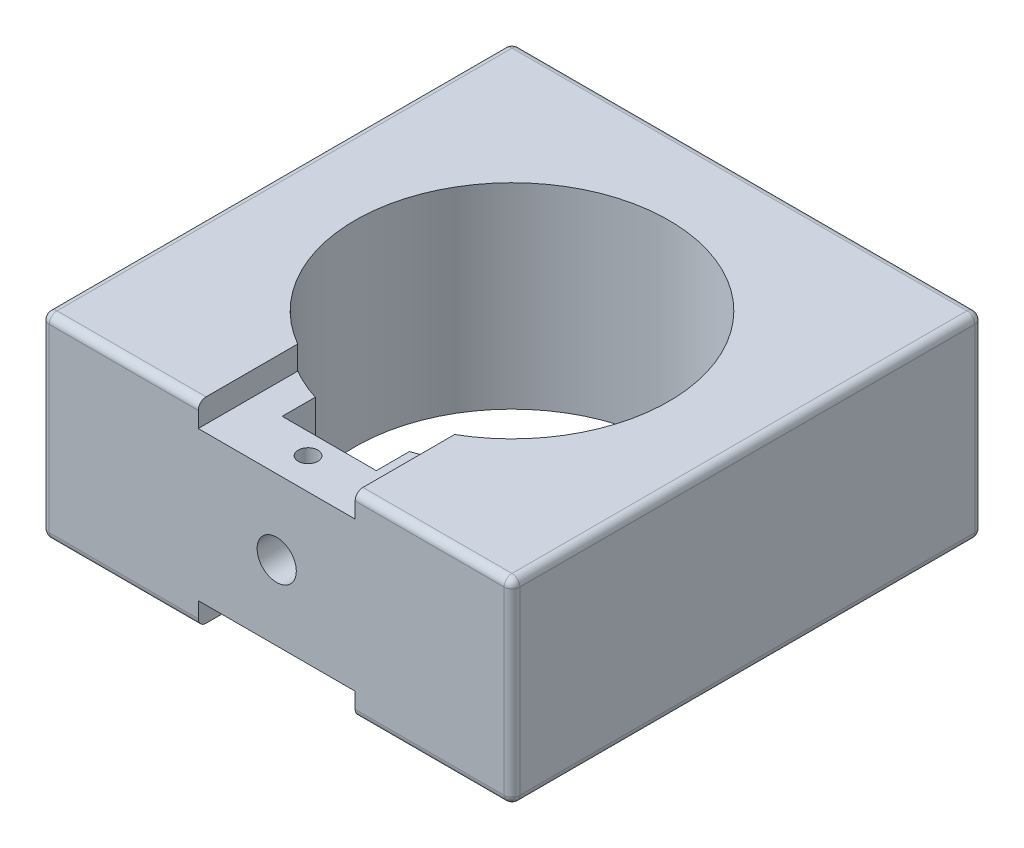
from build123d import *

# Parameters (mm, degrees)
ESQUISSE1_W             = 60
ESQUISSE1_H             = 60
ESQUISSE1_R             = 20
BOSS_EXTRU_1_DEPTH      = 25
CONG_1_R                = 1
TROU_TARAUD_M61_REACH   = 73.589
TROU_TARAUD_M61_BORE_R  = 2.5
TROU_TARAUD_M41_D       = 3.3
TROU_TARAUD_M41_DEPTH   = 7.5
TROU_TARAUD_M41_TIP     = 0.991420021
TROU_TARAUD_M42_D       = 3.3
TROU_TARAUD_M42_DEPTH   = 10.5
TROU_TARAUD_M42_TIP     = 0.991420021
ENL_V_MAT_EXTRU_1_REACH = 51.244
ENL_V_MAT_EXTRU_2_DEPTH = 3


with BuildPart() as part:
    # Esquisse1 → Boss.-Extru.1 (new body)
    with BuildSketch(Plane(origin=(0, 0, 0), x_dir=(1, 0, 0), z_dir=(0, 1, 0))):
        Rectangle(ESQUISSE1_W, ESQUISSE1_H)
        with Locations(Location((0, 0, 0), (0, 0, 270))):
            Circle(ESQUISSE1_R, mode=Mode.SUBTRACT)
    extrude(amount=BOSS_EXTRU_1_DEPTH)

    # Congé1
    cong_1_edges = [part.edges().sort_by_distance(p)[0] for p in [
        (30, 25, 0),
        (0, 25, -30),
        (-30, 25, 0),
        (0, 0, -30),
        (30, 0, 0),
        (0, 0, 30),
        (-30, 0, 0),
        (0, 25, 30),
        (-30, 12.5, -30),
        (30, 12.5, -30),
        (30, 12.5, 30),
        (-30, 12.5, 30),
    ]]
    fillet(cong_1_edges, radius=CONG_1_R)

    # Trou taraudé M61 bore → Trou taraudé M61 (cut, up to next)
    with BuildSketch(Plane.XY.offset(30), mode=Mode.PRIVATE) as trou_taraud_m61_sk1:
        with Locations((0, 12.5)):
            Circle(TROU_TARAUD_M61_BORE_R)
    trou_taraud_m61_tool1 = extrude(trou_taraud_m61_sk1.sketch, amount=-TROU_TARAUD_M61_REACH, mode=Mode.PRIVATE) & part.part
    add(trou_taraud_m61_tool1.solids().sort_by_distance((0, 12.5, 30))[0], mode=Mode.SUBTRACT)

    # Trou taraudé M41
    with Locations(Plane(origin=(0, 0, -30), x_dir=(-1, 0, 0), z_dir=(0, 0, -1))):
        with Locations((11.7, 12.5), (-11.7, 12.5)):
            Hole(TROU_TARAUD_M41_D / 2, depth=TROU_TARAUD_M41_DEPTH)
            with Locations((0, 0, -(TROU_TARAUD_M41_DEPTH + TROU_TARAUD_M41_TIP / 2))):  # 118° drill point
                Cone(0, TROU_TARAUD_M41_D / 2, TROU_TARAUD_M41_TIP, mode=Mode.SUBTRACT)

    # Trou taraudé M42
    with Locations(Plane.ZY.offset(30)):
        with Locations((-9.666666667, 12.5)):
            Hole(TROU_TARAUD_M42_D / 2, depth=TROU_TARAUD_M42_DEPTH)
            with Locations((0, 0, -(TROU_TARAUD_M42_DEPTH + TROU_TARAUD_M42_TIP / 2))):  # 118° drill point
                Cone(0, TROU_TARAUD_M42_D / 2, TROU_TARAUD_M42_TIP, mode=Mode.SUBTRACT)

    # Esquisse10 → Enlèv. mat.-Extru.1 (cut, up to next)
    with BuildSketch(Plane.XZ, mode=Mode.PRIVATE) as enl_v_mat_extru_1_sk1:
        with BuildLine():
            Line((-6, 19.078784028), (-6, 23.3))
            Line((-6, 23.3), (6, 23.3))
            Line((6, 23.3), (6, 19.078784028))
            ThreePointArc((6, 19.078784028), (0, 20), (-6, 19.078784028))
        make_face()
    enl_v_mat_extru_1_tool1 = extrude(enl_v_mat_extru_1_sk1.sketch, amount=-ENL_V_MAT_EXTRU_1_REACH, mode=Mode.PRIVATE) & part.part
    add(enl_v_mat_extru_1_tool1.solids().sort_by_distance((0, 0, 21.487514))[0], mode=Mode.SUBTRACT)

    # Esquisse11 → Enlèv. mat.-Extru.2 (cut)
    with BuildSketch(Plane.XZ):
        with BuildLine():
            Line((-10, 30), (-10, 17.320508076))
            ThreePointArc((-10, 17.320508076), (0, 20), (10, 17.320508076))
            Line((10, 17.320508076), (10, 30))
            Line((10, 30), (-10, 30))
        make_face()
    enl_v_mat_extru_2 = extrude(amount=-ENL_V_MAT_EXTRU_2_DEPTH, mode=Mode.SUBTRACT)

    # Esquisse13 → Trou taraudé M31 (revolve, cut)
    with BuildSketch(Plane(origin=(0, 3, 26), x_dir=(0, 0, -1), z_dir=(1, 0, 0))):
        Polygon((0, 0), (0, 6.251075774), (1.25, 5.5), (1.25, 0), align=None)
    trou_taraud_m31 = revolve(axis=Axis((0, -3.35, 26), (0, 1, 0)), mode=Mode.SUBTRACT)

    # Symétrie1: Enlèv. mat.-Extru.2, Trou taraudé M31 across plane
    add(enl_v_mat_extru_2.mirror(Plane(origin=(0, 12.5, 0), x_dir=(0, 0, 1), z_dir=(0, -1, 0))), mode=Mode.SUBTRACT)
    add(trou_taraud_m31.mirror(Plane(origin=(0, 12.5, 0), x_dir=(0, 0, 1), z_dir=(0, -1, 0))), mode=Mode.SUBTRACT)


solid = part.part
